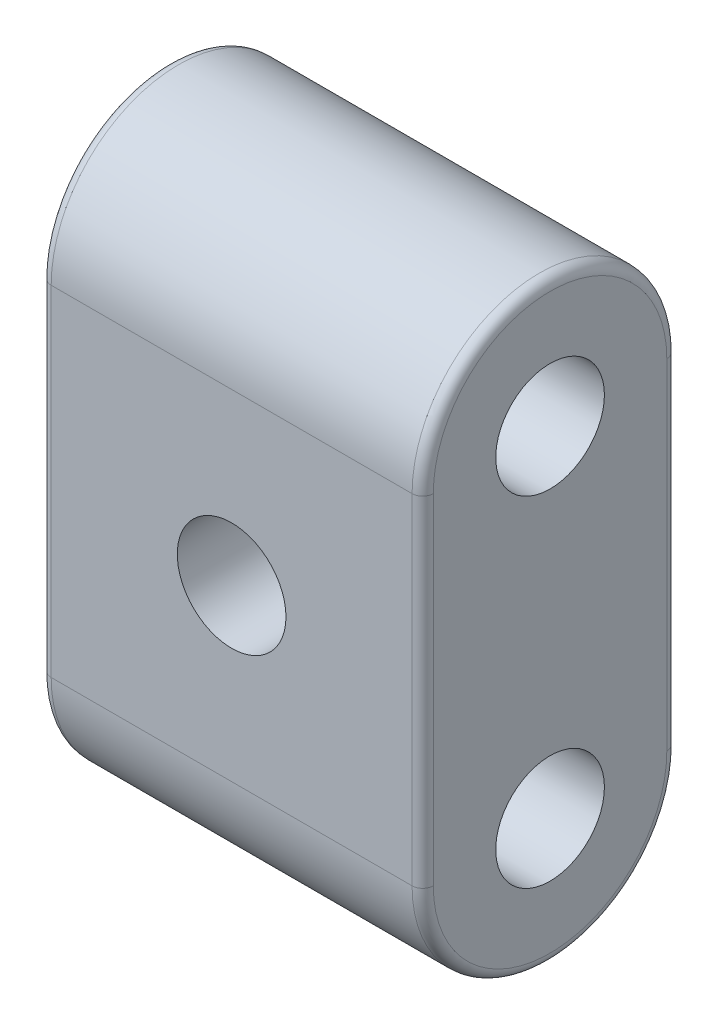
from build123d import *

# Parameters (mm, degrees)
SKETCH1_R           = 2.032
BOSS_EXTRUDE1_DEPTH = 7.14375
SKETCH2_R           = 2.032
CUT_EXTRUDE1_DEPTH  = 22.135224042
FILLET1_R           = 0.396875


with BuildPart() as part:
    # Sketch1 → Boss-Extrude1 (new, symmetric)
    with BuildSketch(Plane(origin=(0, 0, 0), x_dir=(0, 0, -1), z_dir=(1, 0, 0))):
        with BuildLine():
            Line((-4.7625, 0), (-4.7625, 12.7))
            ThreePointArc((-4.7625, 12.7), (0, 17.4625), (4.7625, 12.7))
            Line((4.7625, 12.7), (4.7625, 0))
            ThreePointArc((4.7625, 0), (0, -4.7625), (-4.7625, 0))
        make_face()
        with Locations((0, 12.7)):
            Circle(SKETCH1_R, mode=Mode.SUBTRACT)
        Circle(SKETCH1_R, mode=Mode.SUBTRACT)
    extrude(amount=BOSS_EXTRUDE1_DEPTH, both=True)

    # Sketch2 → Cut-Extrude1 (cut, through all)
    with BuildSketch(Plane.XY.offset(4.7625)):
        with Locations((0, 6.35)):
            Circle(SKETCH2_R)
    extrude(amount=-CUT_EXTRUDE1_DEPTH, mode=Mode.SUBTRACT)

    # Fillet1
    fillet1_edges = [part.edges().sort_by_distance(p)[0] for p in [
        (7.14375, 17.4625, 0),
        (7.14375, 6.35, 4.7625),
        (7.14375, -4.7625, 0),
        (-7.14375, 6.35, 4.7625),
        (-7.14375, 17.4625, 0),
        (-7.14375, 6.35, -4.7625),
        (-7.14375, -4.7625, 0),
        (7.14375, 6.35, -4.7625),
    ]]
    fillet(fillet1_edges, radius=FILLET1_R)


solid = part.part
